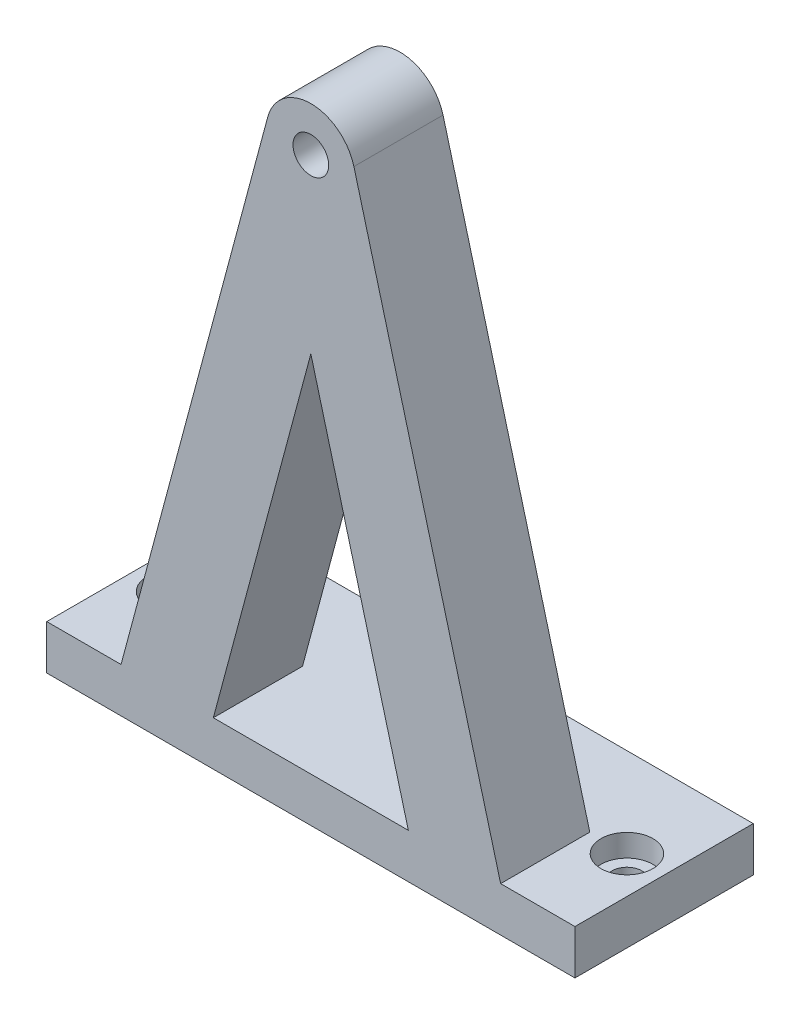
from build123d import *

# Parameters (mm, degrees)
EXTRUDE_1_DEPTH     = 6
SKETCH_3_W          = 35.546514436
SKETCH_3_H          = 12
EXTRUDE_2_DEPTH     = 3
SKETCH_1_5_R        = 1.2
CUT_EXTRUDE_1_DEPTH = 44.348392083
SKETCH_4_R          = 1.75
SKETCH_4_R_2        = 1
CUT_EXTRUDE_2_DEPTH = 1.5
SKETCH_4_2_R        = 1
CUT_EXTRUDE_3_DEPTH = 44.348392083


with BuildPart() as part:
    # 草图1 → 凸台-拉伸1 (new body)
    with BuildSketch(Plane.XY):
        with BuildLine():
            ThreePointArc((2.897777479, 0.776457135), (0, 3), (-2.897777479, 0.776457135))
            Line((-2.897777479, 0.776457135), (-12.773257218, -36.079335))
            Line((-12.773257218, -36.079335), (-6.561600135, -36.079335))
            Line((-6.561600135, -36.079335), (0, -11.591109915))
            Line((0, -11.591109915), (6.561600135, -36.079335))
            Line((6.561600135, -36.079335), (12.773257218, -36.079335))
            Line((12.773257218, -36.079335), (2.897777479, 0.776457135))
        make_face()
    extrude(amount=EXTRUDE_1_DEPTH)

    # 草图3 → 凸台-拉伸2 (add)
    with BuildSketch(Plane.XZ.offset(36.079335)):
        Rectangle(SKETCH_3_W, SKETCH_3_H)
    extrude(amount=EXTRUDE_2_DEPTH)

    # 草图1<5> → 切除-拉伸1 (cut, through all)
    with BuildSketch(Plane.XY):
        Circle(SKETCH_1_5_R)
    extrude(amount=CUT_EXTRUDE_1_DEPTH, mode=Mode.SUBTRACT)

    # 草图4 → 切除-拉伸2 (cut)
    # profile 1 of 3: a face of its own
    with BuildSketch(Plane(origin=(0, -36.079335, 0), x_dir=(1, 0, 0), z_dir=(0, 1, 0))):
        with Locations((15.273257218, 0)):
            Circle(SKETCH_4_R)
        with Locations((15.273257218, 0)):
            Circle(SKETCH_4_R_2, mode=Mode.SUBTRACT)
    # profile 2 of 3: a face of its own
    with BuildSketch(Plane(origin=(0, -36.079335, 0), x_dir=(1, 0, 0), z_dir=(0, 1, 0))):
        with Locations((-15.273257218, 0)):
            Circle(SKETCH_4_R)
        with Locations((-15.273257218, 0)):
            Circle(SKETCH_4_R_2, mode=Mode.SUBTRACT)
    # profile 3 of 3: a face of its own
    with BuildSketch(Plane(origin=(0, -36.079335, 0), x_dir=(1, 0, 0), z_dir=(0, 1, 0))):
        with Locations((0, 3)):
            Circle(SKETCH_4_R)
        with Locations((0, 3)):
            Circle(SKETCH_4_R_2, mode=Mode.SUBTRACT)
    extrude(amount=-CUT_EXTRUDE_2_DEPTH, mode=Mode.SUBTRACT)

    # 草图4<2> → 切除-拉伸3 (cut, through all)
    with BuildSketch(Plane(origin=(0, -36.079335, 0), x_dir=(1, 0, 0), z_dir=(0, 1, 0))):
        with Locations((15.273257218, 0)):
            Circle(SKETCH_4_2_R)
        with Locations((0, 3)):
            Circle(SKETCH_4_2_R)
        with Locations((-15.273257218, 0)):
            Circle(SKETCH_4_2_R)
    extrude(amount=-CUT_EXTRUDE_3_DEPTH, mode=Mode.SUBTRACT)


solid = part.part
